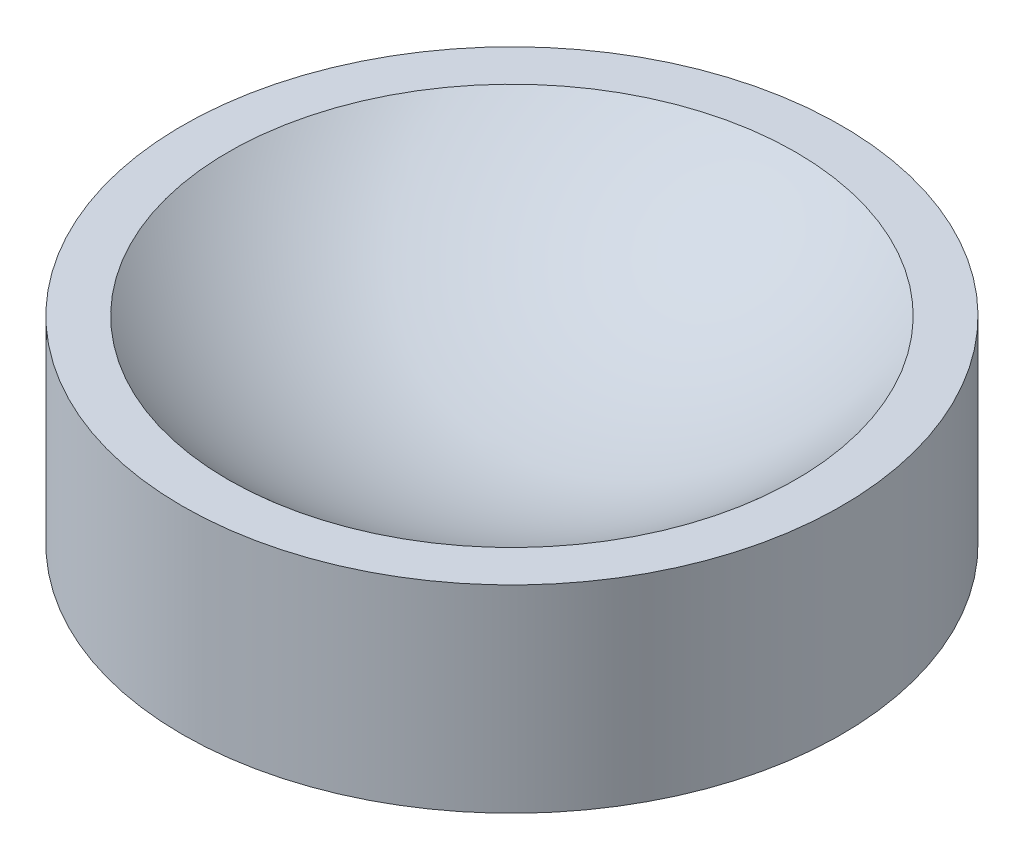
from build123d import *

# Parameters (mm, degrees)
SKETCH_1_R          = 25
EXTRUDE_1_DEPTH     = 15
CUT_REVOLVE_1_ANGLE = 270


with BuildPart() as part:
    # 草图1 → 凸台-拉伸1 (new body)
    with BuildSketch(Plane(origin=(0, 0, 0), x_dir=(1, 0, 0), z_dir=(0, 1, 0))):
        with Locations(Location((0, 0, 0), (0, 0, 270))):
            Circle(SKETCH_1_R)
    extrude(amount=EXTRUDE_1_DEPTH)

    # 草图2 → 切除-旋转1 (revolve, cut)
    with BuildSketch(Plane.XY):
        with BuildLine():
            Line((-31.5, 38), (0, 38))
            Line((0, 38), (31.5, 38))
            ThreePointArc((31.5, 38), (0, 69.5), (-31.5, 38))
        make_face()
    revolve(axis=Axis((0, 38, 0), (1, 0, 0)), revolution_arc=CUT_REVOLVE_1_ANGLE, mode=Mode.SUBTRACT)


solid = part.part
